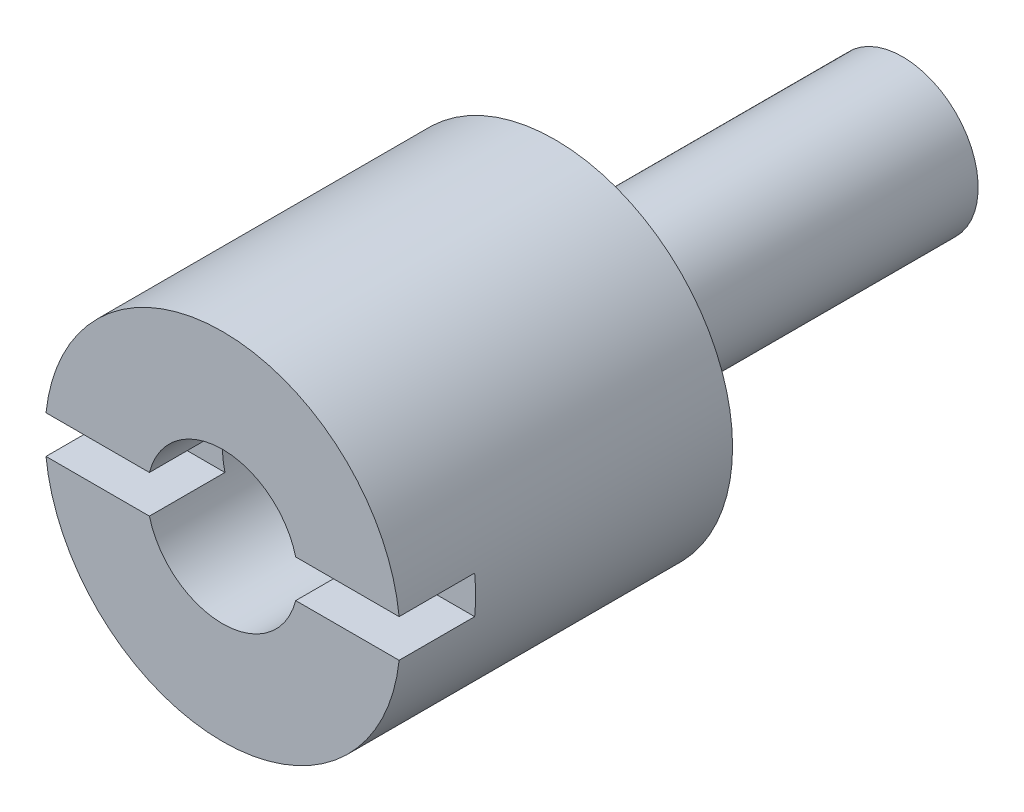
from build123d import *

# Parameters (mm, degrees)
SKETCH_1_R          = 2.35
SKETCH_1_R_2        = 1
EXTRUDE_1_DEPTH     = 4.4
SKETCH_2_W          = 5
SKETCH_2_H          = 0.5
CUT_EXTRUDE_1_DEPTH = 1
SKETCH_3_R          = 1
EXTRUDE_2_DEPTH     = 4.6


with BuildPart() as part:
    # 草图1 → 凸台-拉伸1 (new body)
    with BuildSketch(Plane.XY):
        Circle(SKETCH_1_R)
        Circle(SKETCH_1_R_2, mode=Mode.SUBTRACT)
    extrude(amount=EXTRUDE_1_DEPTH)

    # 草图2 → 切除-拉伸1 (cut)
    with BuildSketch(Plane.XY.offset(4.4)):
        Rectangle(SKETCH_2_W, SKETCH_2_H)
    extrude(amount=-CUT_EXTRUDE_1_DEPTH, mode=Mode.SUBTRACT)


with BuildPart() as body_2:
    # 草图3 → 凸台-拉伸2 (new body)
    with BuildSketch(Plane(origin=(0, 0, 0), x_dir=(-1, 0, 0), z_dir=(0, 0, -1))):
        Circle(SKETCH_3_R)
    extrude(amount=EXTRUDE_2_DEPTH)


solid = Compound([part.part, body_2.part])
